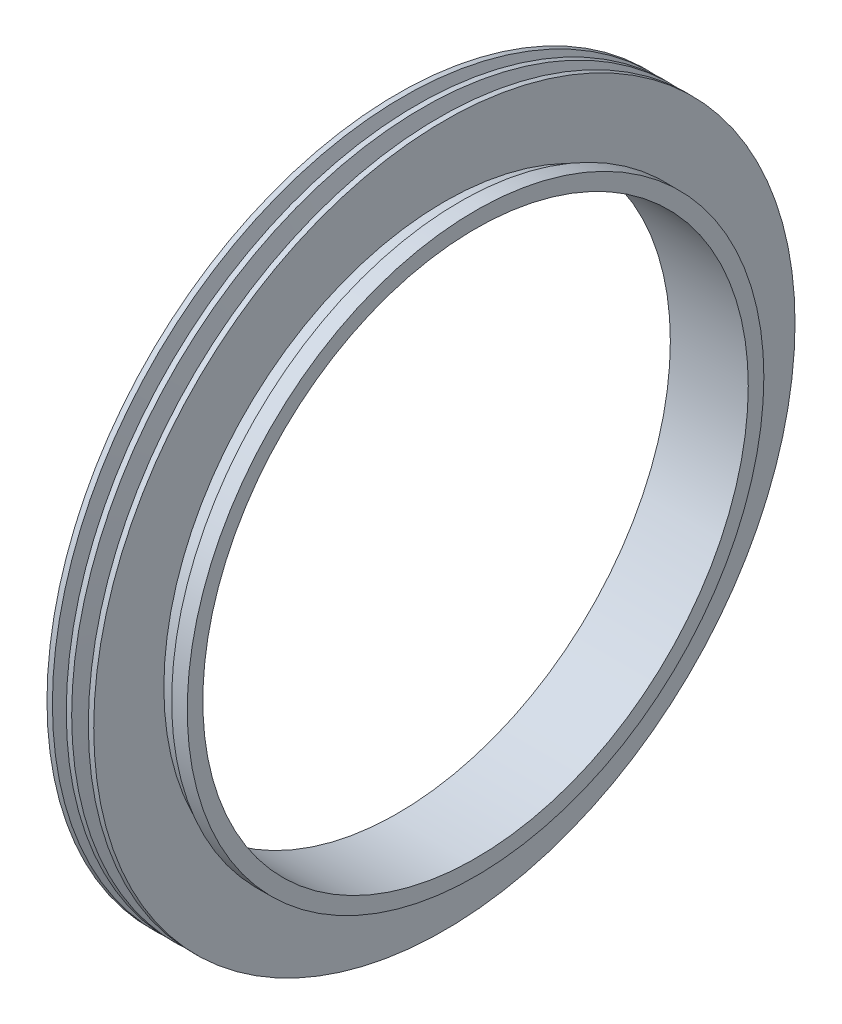
from build123d import *


with BuildPart() as part:
    # Szkic1 → Obrót1 (revolve)
    with BuildSketch(Plane.XY, mode=Mode.PRIVATE) as obr_t1_sk:
        Polygon((-4.081701013, 20.911565577), (-4.283998784, 20.911565577), (-4.652565061, 22.5), (-5, 22.5), (-5, 17.5), (0, 17.5), (0, 18.5), (-1, 18.5), (-1, 18), (-2, 18), (-2, 22.5), (-2.347434939, 22.5), (-2.899277053, 20.911565577), (-3.101574823, 20.911565577), (-3.415520415, 22.5), (-3.762955354, 22.5), align=None)
    revolve(obr_t1_sk.sketch.rotate(Axis((0, 0, 0), (-1, 0, 0)), 90), axis=Axis((0, 0, 0), (-1, 0, 0)))


solid = part.part
